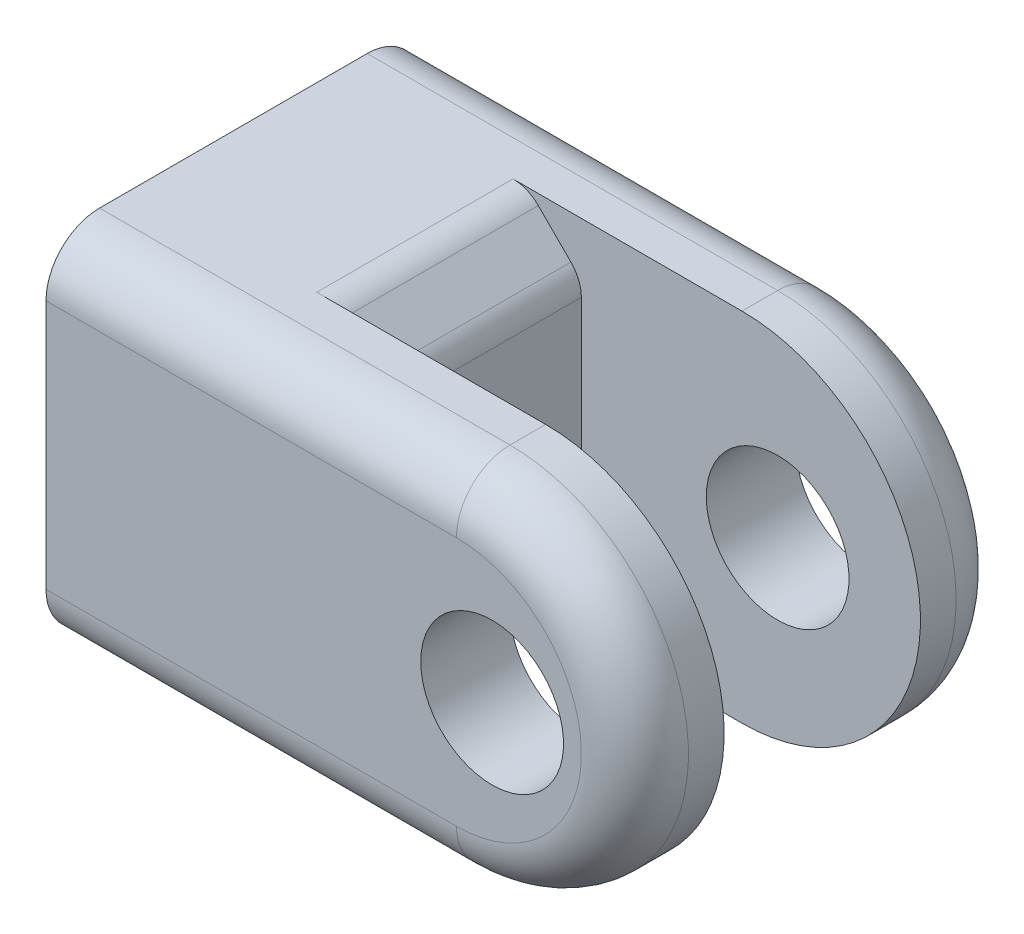
from build123d import *

# Parameters (mm, degrees)
SKETCH1_R                 = 4
BOSS_EXTRUDE1_DEPTH       = 21
SKETCH2_W                 = 19
SKETCH2_H                 = 11
CUT_EXTRUDE1_DEPTH        = 20
SKETCH3_R                 = 8.5
CUT_EXTRUDE2_DEPTH        = 12
M2X0_4_TAPPED_HOLE1_D     = 1.6
M2X0_4_TAPPED_HOLE1_DEPTH = 8
M2X0_4_TAPPED_HOLE1_TIP   = 0.480688495
FILLET2_R                 = 3
CHAMFER1_SIZE             = 3
FILLET3_R                 = 2


with BuildPart() as part:
    # Sketch1 → Boss-Extrude1 (new body)
    with BuildSketch(Plane.XY):
        with BuildLine():
            Line((0, 0), (0, 20))
            Line((0, 20), (23, 20))
            ThreePointArc((23, 20), (33, 10), (23, 0))
            Line((23, 0), (0, 0))
        make_face()
        with Locations(Location((25, 10, 0), (0, 0, 180))):
            Circle(SKETCH1_R, mode=Mode.SUBTRACT)
    extrude(amount=BOSS_EXTRUDE1_DEPTH)

    # Sketch2 → Cut-Extrude1 (cut)
    with BuildSketch(Plane(origin=(0, 20, 0), x_dir=(1, 0, 0), z_dir=(0, 1, 0))):
        with Locations((23.5, -10.5)):
            Rectangle(SKETCH2_W, SKETCH2_H)
    extrude(amount=-CUT_EXTRUDE1_DEPTH, mode=Mode.SUBTRACT)

    # Sketch3 → Cut-Extrude2 (cut)
    with BuildSketch(Plane.ZY):
        with Locations(Location((10.5, 10, 0), (0, 0, 270))):
            Circle(SKETCH3_R)
    extrude(amount=-CUT_EXTRUDE2_DEPTH, mode=Mode.SUBTRACT)

    # M2x0.4 Tapped Hole1
    with Locations(Plane.ZY):
        with Locations((2, 17.5), (19, 17.5), (19, 2.5), (2, 2.5)):
            Hole(M2X0_4_TAPPED_HOLE1_D / 2, depth=M2X0_4_TAPPED_HOLE1_DEPTH)
            with Locations((0, 0, -(M2X0_4_TAPPED_HOLE1_DEPTH + M2X0_4_TAPPED_HOLE1_TIP / 2))):  # 118° drill point
                Cone(0, M2X0_4_TAPPED_HOLE1_D / 2, M2X0_4_TAPPED_HOLE1_TIP, mode=Mode.SUBTRACT)

    # Fillet2
    fillet2_edges = [part.edges().sort_by_distance(p)[0] for p in [
        (11.5, 20, 21),
        (11.5, 0, 21),
        (11.5, 20, 0),
        (33, 10, 0),
        (11.5, 0, 0),
        (33, 10, 21),
    ]]
    fillet(fillet2_edges, radius=FILLET2_R)

    # Chamfer1
    chamfer1_edges = [part.edges().sort_by_distance(p)[0] for p in [
        (14, 0, 10.5),
        (14, 20, 10.5),
    ]]
    chamfer(chamfer1_edges, length=CHAMFER1_SIZE)

    # Fillet3
    fillet3_edges = [part.edges().sort_by_distance(p)[0] for p in [
        (14, 17, 10.5),
        (14, 3, 10.5),
        (11, 0, 10.5),
        (11, 20, 10.5),
    ]]
    fillet(fillet3_edges, radius=FILLET3_R)


solid = part.part
